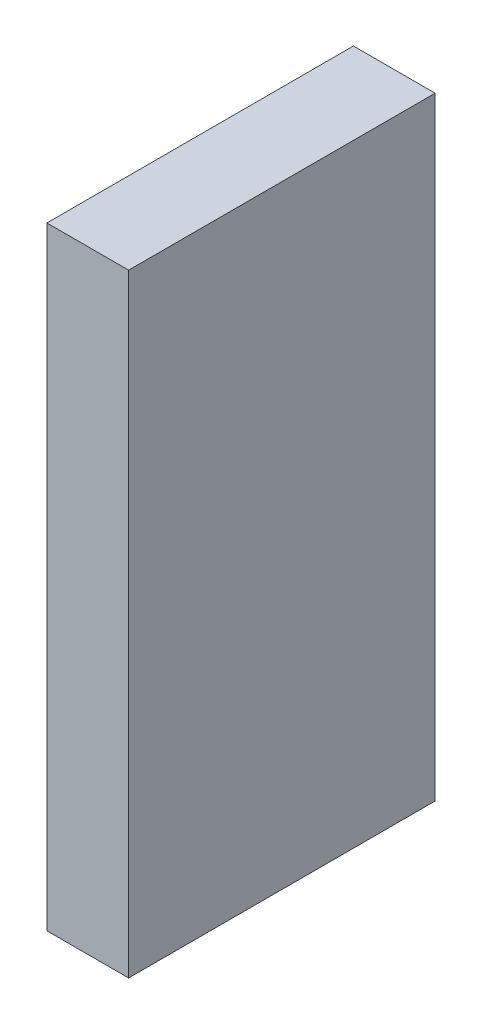
from build123d import *

# Parameters (mm, degrees)
PACK_FLAP_PARMAGI_1_1_START = -185
SKETCH1_W                   = 8
SKETCH1_H                   = 60
PACK_FLAP_PARMAGI_1_1_DEPTH = 30


with BuildPart() as part:
    # Sketch1 → PACK_flap_parmagi_1_1 (new body)
    with BuildSketch(Plane.XY.offset(PACK_FLAP_PARMAGI_1_1_START)):
        with Locations((150, 730)):
            Rectangle(SKETCH1_W, SKETCH1_H)
    extrude(amount=-PACK_FLAP_PARMAGI_1_1_DEPTH)


solid = part.part
